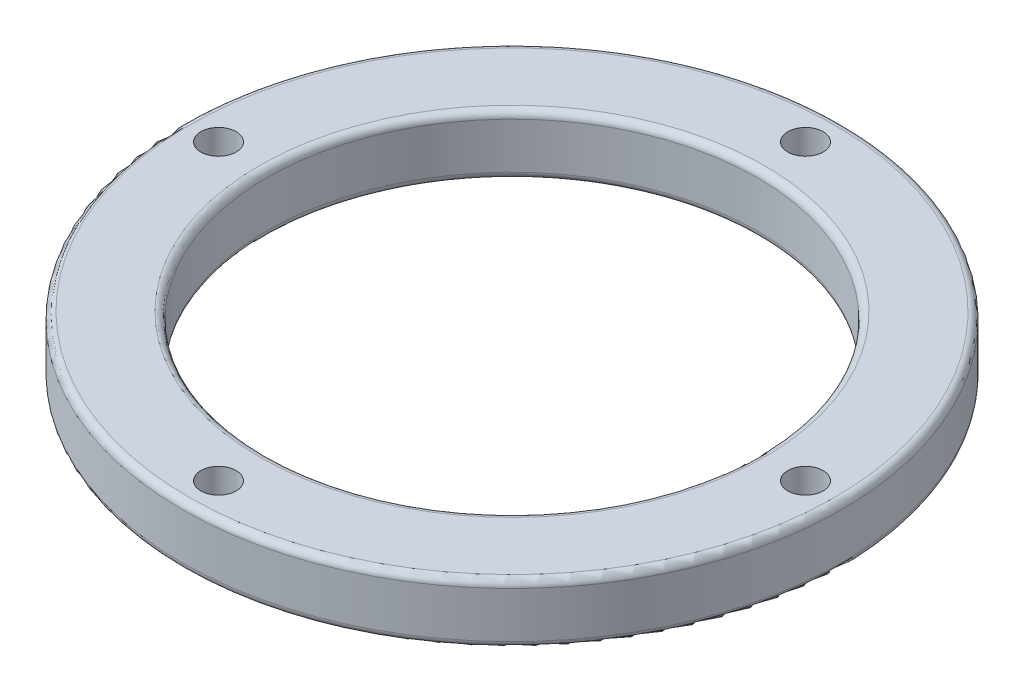
from build123d import *

# Parameters (mm, degrees)
SKETCH1_R           = 46.6
SKETCH1_R_2         = 34.7
SKETCH1_R_3         = 2.5
BOSS_EXTRUDE1_DEPTH = 8.5
FILLET1_R           = 1


with BuildPart() as part:
    # Sketch1 → Boss-Extrude1 (new body)
    with BuildSketch(Plane(origin=(0, 0, 0), x_dir=(1, 0, 0), z_dir=(0, 1, 0))):
        with Locations(Location((0, 0, 0), (0, 0, 270))):
            Circle(SKETCH1_R)
        with Locations(Location((0, 0, 0), (0, 0, 270))):
            Circle(SKETCH1_R_2, mode=Mode.SUBTRACT)
        with Locations(Location((0, 41.5, 0), (0, 0, 270))):
            Circle(SKETCH1_R_3, mode=Mode.SUBTRACT)
        with Locations(Location((41.5, 0, 0), (0, 0, 270))):
            Circle(SKETCH1_R_3, mode=Mode.SUBTRACT)
        with Locations(Location((0, -41.5, 0), (0, 0, 270))):
            Circle(SKETCH1_R_3, mode=Mode.SUBTRACT)
        with Locations(Location((-41.5, 0, 0), (0, 0, 270))):
            Circle(SKETCH1_R_3, mode=Mode.SUBTRACT)
    extrude(amount=BOSS_EXTRUDE1_DEPTH)

    # Fillet1
    fillet1_edges = [part.edges().sort_by_distance(p)[0] for p in [
        (0, 0, -46.6),
        (0, 8.5, -46.6),
        (0, 0, -34.7),
        (0, 8.5, -34.7),
    ]]
    fillet(fillet1_edges, radius=FILLET1_R)


solid = part.part
